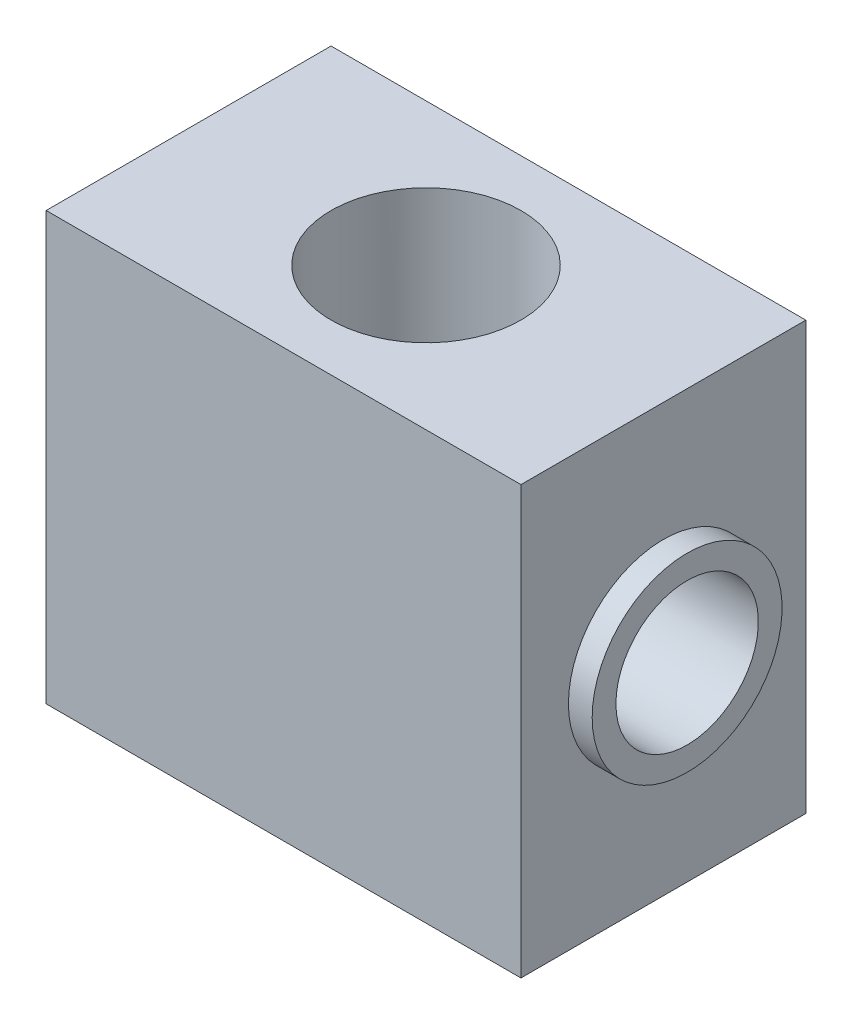
from build123d import *

# Parameters (mm, degrees)
SKETCH1_W           = 31.75
SKETCH1_H           = 28.575
BOSS_EXTRUDE1_DEPTH = 9.525
SKETCH2_R           = 6.35
CUT_EXTRUDE1_DEPTH  = 35.048081811
SKETCH3_R           = 4.7625
CUT_EXTRUDE2_DEPTH  = 37.095993978
BOSS_EXTRUDE2_START = 1.5875
SKETCH4_R           = 6.35
SKETCH4_R_2         = 4.7625
BOSS_EXTRUDE2_DEPTH = 1.5875


with BuildPart() as part:
    # Sketch1 → Boss-Extrude1 (new, symmetric)
    with BuildSketch(Plane.XY):
        Rectangle(SKETCH1_W, SKETCH1_H)
    extrude(amount=BOSS_EXTRUDE1_DEPTH, both=True)

    # Sketch2 → Cut-Extrude1 (cut, through all)
    with BuildSketch(Plane.XZ.offset(14.2875)):
        with Locations(Location((0, 0, 0), (0, 0, 270))):
            Circle(SKETCH2_R)
    extrude(amount=-CUT_EXTRUDE1_DEPTH, mode=Mode.SUBTRACT)

    # Sketch3 → Cut-Extrude2 (cut, through all)
    with BuildSketch(Plane.ZY.offset(15.875)):
        Circle(SKETCH3_R)
    extrude(amount=-CUT_EXTRUDE2_DEPTH, mode=Mode.SUBTRACT)

    # Sketch4 → Boss-Extrude2 (add)
    with BuildSketch(Plane.ZY.offset(15.875).offset(BOSS_EXTRUDE2_START)):
        with Locations(Location((0, 0, 0), (0, 0, 180))):
            Circle(SKETCH4_R)
        Circle(SKETCH4_R_2, mode=Mode.SUBTRACT)
    boss_extrude2 = extrude(amount=-BOSS_EXTRUDE2_DEPTH)

    # Mirror1: Boss-Extrude2 across plane
    add(boss_extrude2.mirror(Plane(origin=(0, 0, 0), x_dir=(0, 0, 1), z_dir=(1, 0, 0))))


solid = part.part
